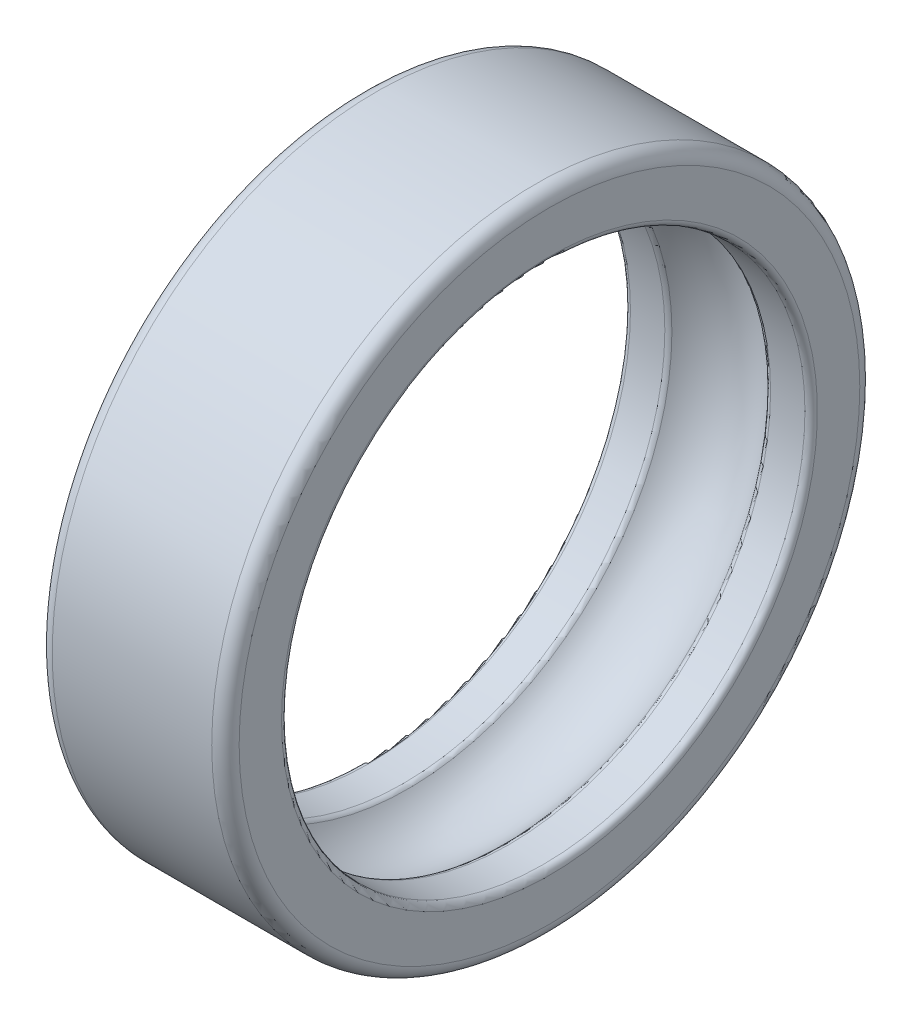
from build123d import *

# Parameters (mm, degrees)
FILLET1_R = 1.1
FILLET2_R = 0.5


with BuildPart() as part:
    # Sketch1 → Revolve1 (revolve)
    with BuildSketch(Plane(origin=(0, 0, 0), x_dir=(-1, 0, 0), z_dir=(0, 1, 0)), mode=Mode.PRIVATE) as revolve1_sk:
        with BuildLine():
            Line((-7.5, 21), (-7.5, 26))
            Line((-7.5, 26), (7.5, 26))
            Line((7.5, 26), (7.5, 21))
            Line((7.5, 21), (4, 21))
            ThreePointArc((4, 21), (0, 23), (-4, 21))
            Line((-4, 21), (-7.5, 21))
        make_face()
    revolve(revolve1_sk.sketch.rotate(Axis((12.943925234, 0, 0), (-1, 0, 0)), 180), axis=Axis((12.943925234, 0, 0), (-1, 0, 0)))

    # Fillet1
    fillet1_edges = [part.edges().sort_by_distance(p)[0] for p in [
        (7.5, 0, 26),
        (-7.5, 0, 26),
    ]]
    fillet(fillet1_edges, radius=FILLET1_R)

    # Fillet2
    fillet2_edges = [part.edges().sort_by_distance(p)[0] for p in [
        (7.5, 0, 21),
        (-7.5, 0, 21),
        (-4, 0, 21),
        (4, 0, 21),
    ]]
    fillet(fillet2_edges, radius=FILLET2_R)


solid = part.part
